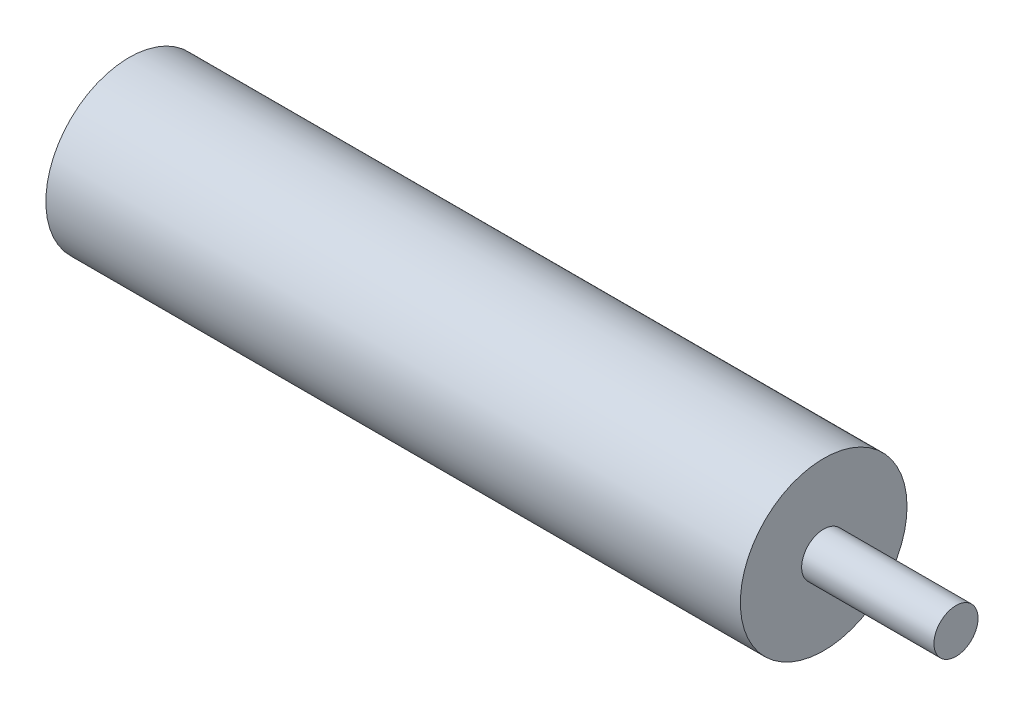
from build123d import *

# Parameters (mm, degrees)
SKETCH1_R           = 6
BOSS_EXTRUDE1_DEPTH = 50
SKETCH2_R           = 1.5875
BOSS_EXTRUDE2_DEPTH = 9.525


with BuildPart() as part:
    # Sketch1 → Boss-Extrude1 (new body)
    with BuildSketch(Plane(origin=(0, 0, 0), x_dir=(0, 0, -1), z_dir=(1, 0, 0))):
        Circle(SKETCH1_R)
    extrude(amount=BOSS_EXTRUDE1_DEPTH)

    # Sketch2 → Boss-Extrude2 (add)
    with BuildSketch(Plane(origin=(50, 0, 0), x_dir=(0, 0, -1), z_dir=(1, 0, 0))):
        with Locations(Location((0, 0, 0), (0, 0, 180))):
            Circle(SKETCH2_R)
    extrude(amount=BOSS_EXTRUDE2_DEPTH)


solid = part.part
